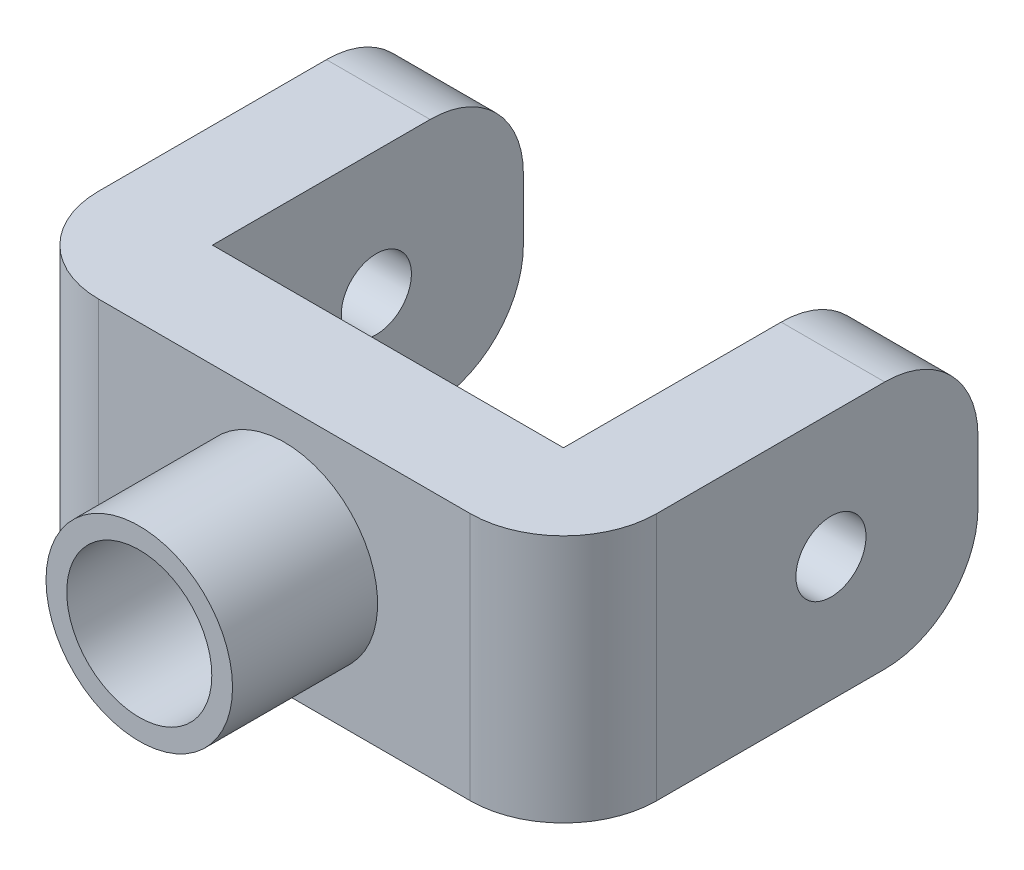
from build123d import *

# Parameters (mm, degrees)
BOSS_EXTRUDE1_DEPTH     = 12
SKETCH2_R               = 7
CUT_EXTRUDE1_DEPTH      = 17
BOSS_EXTRUDE2_START     = 14
SKETCH2_3_R             = 9
SKETCH2_3_R_2           = 7
BOSS_EXTRUDE2_DEPTH     = 14
CUT_EXTRUDE2_DEPTH      = 16
CUT_EXTRUDE2_DEPTH_BACK = 69
SKETCH5_R               = 3.382435313
FILLET2_R               = 9
FILLET3_R               = 9


with BuildPart() as part:
    # Sketch1 → Boss-Extrude1 (new, symmetric)
    with BuildSketch(Plane(origin=(0, 0, 0), x_dir=(1, 0, 0), z_dir=(0, 1, 0))):
        Polygon((-16.935483871, 6.948519541), (16.935483871, 6.948519541), (16.935483871, 36.948519541), (26.935483871, 36.948519541), (26.935483871, -3.051480459), (-26.935483871, -3.051480459), (-26.935483871, 36.948519541), (-16.935483871, 36.948519541), align=None)
    extrude(amount=BOSS_EXTRUDE1_DEPTH, both=True)

    # Sketch2 → Cut-Extrude1 (cut, symmetric)
    with BuildSketch(Plane.XY.offset(3.051480459)):
        Circle(SKETCH2_R)
    extrude(amount=CUT_EXTRUDE1_DEPTH, both=True, mode=Mode.SUBTRACT)

    # Sketch2<3> → Boss-Extrude2 (add)
    with BuildSketch(Plane.XY.offset(3.051480459).offset(BOSS_EXTRUDE2_START)):
        Circle(SKETCH2_3_R)
        Circle(SKETCH2_3_R_2, mode=Mode.SUBTRACT)
    extrude(amount=-BOSS_EXTRUDE2_DEPTH)

    # Sketch5 → Cut-Extrude2 (cut, two sides: drawn at the far end of the back side and taken through both)
    with BuildSketch(Plane(origin=(26.935483871, 0, 0), x_dir=(0, 0, -1), z_dir=(1, 0, 0)).offset(-CUT_EXTRUDE2_DEPTH_BACK)):
        with Locations((22.7618385, 0)):
            Circle(SKETCH5_R)
    extrude(amount=CUT_EXTRUDE2_DEPTH + CUT_EXTRUDE2_DEPTH_BACK, mode=Mode.SUBTRACT)

    # Fillet2
    fillet2_edges = [part.edges().sort_by_distance(p)[0] for p in [
        (-21.935483871, 12, -36.948519541),
        (-21.935483871, -12, -36.948519541),
        (21.935483871, -12, -36.948519541),
        (21.935483871, 12, -36.948519541),
    ]]
    fillet(fillet2_edges, radius=FILLET2_R)

    # Fillet3
    fillet3_edges = [part.edges().sort_by_distance(p)[0] for p in [
        (-26.935483871, 0, 3.051480459),
        (26.935483871, 0, 3.051480459),
    ]]
    fillet(fillet3_edges, radius=FILLET3_R)


solid = part.part
